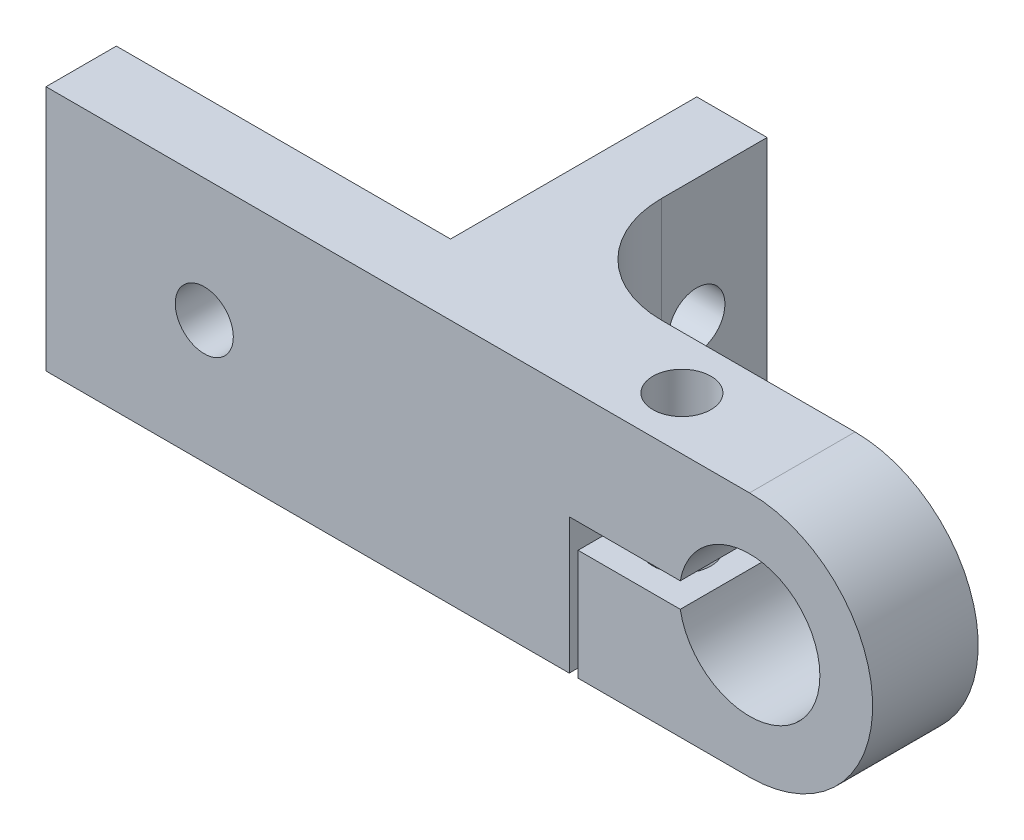
from build123d import *

# Parameters (mm, degrees)
ESBO_O2_R                  = 1.65
RESSALTO_EXTRUS_O1_DEPTH   = 18
CORTE_EXTRUS_O1_DEPTH      = 47.043457733
CORTE_EXTRUS_O1_DEPTH_BACK = 47.043457733
ESBO_O3_R                  = 1.65
ESBO_O3_W                  = 19
ESBO_O3_H                  = 14
ESBO_O4_R                  = 1.6
CORTE_EXTRUS_O2_DEPTH      = 18


with BuildPart() as part:
    # Esboço2 → Ressalto-extrusão1 (new body)
    with BuildSketch(Plane.XY):
        with BuildLine():
            Line((0, 7), (-40, 7))
            Line((-40, 7), (-40, -7))
            Line((-40, -7), (-10.25, -7))
            Line((-10.25, -7), (-10.25, 0.7))
            Line((-10.25, 0.7), (-3.938273734, 0.7))
            ThreePointArc((-3.938273734, 0.7), (4, 0), (-3.938273734, -0.7))
            Line((-3.938273734, -0.7), (-9.75, -0.7))
            Line((-9.75, -0.7), (-9.75, -7))
            Line((-9.75, -7), (0, -7))
            ThreePointArc((0, -7), (7, 0), (0, 7))
        make_face()
        with Locations((-31, 0)):
            Circle(ESBO_O2_R, mode=Mode.SUBTRACT)
    extrude(amount=RESSALTO_EXTRUS_O1_DEPTH)

    # Esboço3 → Corte-extrusão1 (cut, two sides: drawn at the far end of the back side and taken through both)
    with BuildSketch(Plane.XZ.offset(7).offset(-CORTE_EXTRUS_O1_DEPTH_BACK)):
        with Locations((-6.844136867, 15)):
            Circle(ESBO_O3_R)
        with Locations((-30.5, 7)):
            Rectangle(ESBO_O3_W, ESBO_O3_H)
        with BuildLine():
            Line((7, 12), (-11, 12))
            ThreePointArc((-11, 12), (-15.242640687, 10.242640687), (-17, 6))
            Line((-17, 6), (-17, 0))
            Line((-17, 0), (7, 0))
            Line((7, 0), (7, 12))
        make_face()
    extrude(amount=CORTE_EXTRUS_O1_DEPTH + CORTE_EXTRUS_O1_DEPTH_BACK, mode=Mode.SUBTRACT)

    # Esboço4 → Corte-extrusão2 (cut)
    with BuildSketch(Plane.ZY.offset(21)):
        with Locations((4, 0)):
            Circle(ESBO_O4_R)
    extrude(amount=-CORTE_EXTRUS_O2_DEPTH, mode=Mode.SUBTRACT)


solid = part.part
